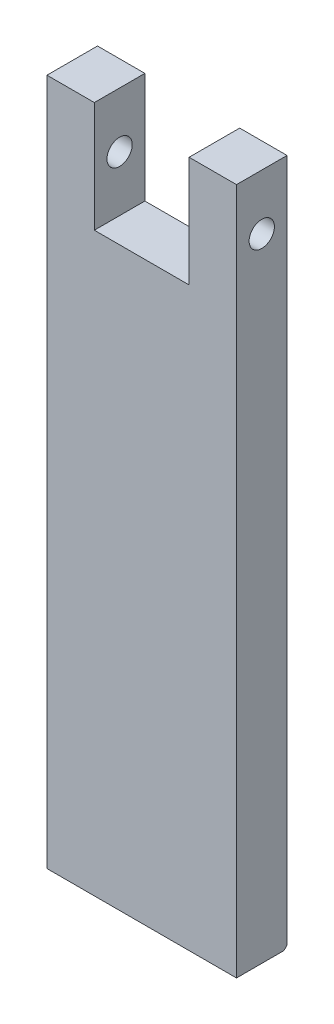
from build123d import *

# Parameters (mm, degrees)
SKETCH1_W               = 60
SKETCH1_H               = 250
BOSS_EXTRUDE1_DEPTH     = 16
CHAMFER1_SIZE           = 1
SKETCH2_R               = 2
CUT_EXTRUDE1_DEPTH      = 15
CUT_EXTRUDE4_REACH      = 259.597
SKETCH5_W               = 30
SKETCH5_H               = 35
CUT_EXTRUDE5_DEPTH      = 255.521118967
CUT_EXTRUDE5_DEPTH_BACK = 255.521118967
SKETCH6_R               = 4
SKETCH7_W               = 60
SKETCH7_H               = 32.5
CUT_EXTRUDE6_DEPTH      = 258.596583828


with BuildPart() as part:
    # Sketch1 → Boss-Extrude1 (new body)
    with BuildSketch(Plane.XY):
        with Locations((30, 125)):
            Rectangle(SKETCH1_W, SKETCH1_H)
    extrude(amount=BOSS_EXTRUDE1_DEPTH)

    # Chamfer1
    chamfer1_edges = [part.edges().sort_by_distance(p)[0] for p in [
        (30, 0, 0),
    ]]
    chamfer(chamfer1_edges, length=CHAMFER1_SIZE)

    # Sketch2 → Cut-Extrude1 (cut)
    with BuildSketch(Plane(origin=(0, 0, 0), x_dir=(-1, 0, 0), z_dir=(0, -1, 0))):
        with Locations(Location((-41.5, -8.5, 0), (0, 0, 90))):
            Circle(SKETCH2_R)
        with Locations(Location((-18.5, -8.5, 0), (0, 0, 90))):
            Circle(SKETCH2_R)
    extrude(amount=-CUT_EXTRUDE1_DEPTH, mode=Mode.SUBTRACT)

    # Sketch5 → Cut-Extrude4 (cut, up to next)
    with BuildSketch(Plane(origin=(0, 0, 0), x_dir=(-1, 0, 0), z_dir=(0, 0, -1)), mode=Mode.PRIVATE) as cut_extrude4_sk1:
        with Locations((-30, 200)):
            Rectangle(SKETCH5_W, SKETCH5_H)
    cut_extrude4_tool1 = extrude(cut_extrude4_sk1.sketch, amount=-CUT_EXTRUDE4_REACH, mode=Mode.PRIVATE) & part.part
    add(cut_extrude4_tool1.solids().sort_by_distance((30, 200, 0))[0], mode=Mode.SUBTRACT)

    # Sketch6 → Cut-Extrude5 (cut, two sides: drawn at the far end of the back side and taken through both)
    with BuildSketch(Plane.ZY.offset(-45).offset(-CUT_EXTRUDE5_DEPTH_BACK)):
        with Locations((8, 200)):
            Circle(SKETCH6_R)
    extrude(amount=CUT_EXTRUDE5_DEPTH + CUT_EXTRUDE5_DEPTH_BACK, mode=Mode.SUBTRACT)

    # Sketch7 → Cut-Extrude6 (cut, through all)
    with BuildSketch(Plane(origin=(0, 0, 0), x_dir=(-1, 0, 0), z_dir=(0, 0, -1))):
        with Locations((-30, 233.75)):
            Rectangle(SKETCH7_W, SKETCH7_H)
    extrude(amount=-CUT_EXTRUDE6_DEPTH, mode=Mode.SUBTRACT)


solid = part.part
